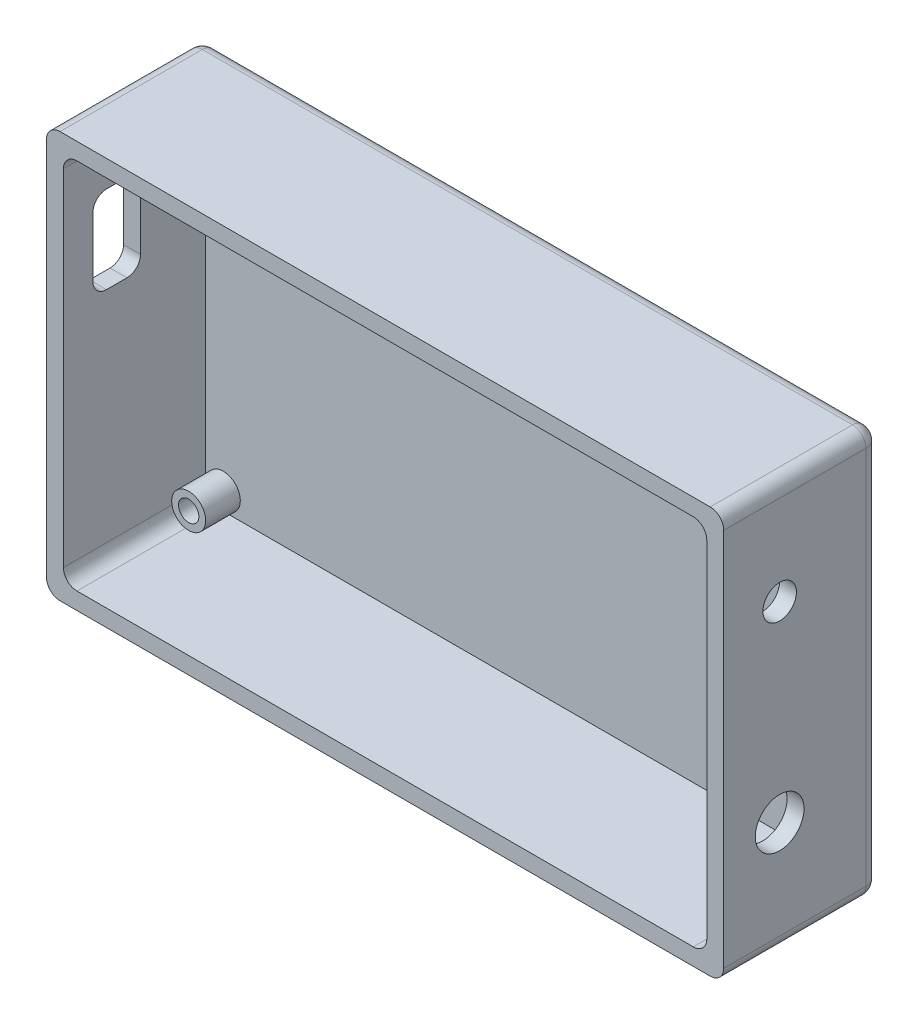
from build123d import *

# Parameters (mm, degrees)
SKETCH1_W                 = 100
SKETCH1_H                 = 60
BOSS_EXTRUDE1_DEPTH       = 23
SKETCH2_W                 = 95
SKETCH2_H                 = 55
CUT_EXTRUDE1_DEPTH        = 21
SKETCH3_R                 = 2.51
SKETCH3_R_2               = 1.5
BOSS_EXTRUDE6_DEPTH       = 5.112
MIRROR2_COPY_1_SKETCH_R   = 2.51
MIRROR2_COPY_1_SKETCH_R_2 = 1.5
MIRROR2_COPY_1_DEPTH      = 5.112
FILLET1_R                 = 2
CUT_EXTRUDE2_REACH        = 108.907
SKETCH4_W                 = 7.027664142
SKETCH4_H                 = 12.863273411
FILLET2_R                 = 2
CUT_EXTRUDE3_REACH        = 108.907
SKETCH5_R                 = 3.6
SKETCH5_R_2               = 2.475


with BuildPart() as part:
    # Sketch1 → Boss-Extrude1 (new body)
    with BuildSketch(Plane.XY):
        Rectangle(SKETCH1_W, SKETCH1_H)
    extrude(amount=BOSS_EXTRUDE1_DEPTH)

    # Sketch2 → Cut-Extrude1 (cut)
    with BuildSketch(Plane.XY.offset(23)):
        Rectangle(SKETCH2_W, SKETCH2_H)
    extrude(amount=-CUT_EXTRUDE1_DEPTH, mode=Mode.SUBTRACT)

    # Sketch3 → Boss-Extrude6 (add)
    with BuildSketch(Plane.XY.offset(2)):
        with Locations((-44.89, 24.89)):
            Circle(SKETCH3_R)
        with Locations((-44.89, 24.89)):
            Circle(SKETCH3_R_2, mode=Mode.SUBTRACT)
    boss_extrude6 = extrude(amount=BOSS_EXTRUDE6_DEPTH)

    # Mirror1: Boss-Extrude6 across plane
    add(boss_extrude6.mirror(Plane.ZX))

    # Mirror2: Boss-Extrude6 across plane
    add(boss_extrude6.mirror(Plane(origin=(0, 0, 0), x_dir=(0, 0, 1), z_dir=(1, 0, 0))))

    # Mirror2 copy 1 sketch → Mirror2 copy 1 (add)
    with BuildSketch(Plane(origin=(0, 0, 2), x_dir=(-1, 0, 0), z_dir=(0, 0, 1))):
        with Locations((-44.89, 24.89)):
            Circle(MIRROR2_COPY_1_SKETCH_R)
        with Locations((-44.89, 24.89)):
            Circle(MIRROR2_COPY_1_SKETCH_R_2, mode=Mode.SUBTRACT)
    extrude(amount=MIRROR2_COPY_1_DEPTH)

    # Fillet1
    fillet1_edges = [part.edges().sort_by_distance(p)[0] for p in [
        (-47.5, 27.5, 12.5),
        (47.5, 27.5, 12.5),
        (47.5, -27.5, 12.5),
        (-47.5, -27.5, 12.5),
        (0, -30, 0),
        (-50, 0, 0),
        (0, 30, 0),
        (50, 0, 0),
        (50, -30, 11.5),
        (-50, -30, 11.5),
        (-50, 30, 11.5),
        (50, 30, 11.5),
    ]]
    fillet(fillet1_edges, radius=FILLET1_R)

    # Sketch4 → Cut-Extrude2 (cut, up to next)
    with BuildSketch(Plane.ZY.offset(50), mode=Mode.PRIVATE) as cut_extrude2_sk1:
        with Locations((15.125832071, 13.291636706)):
            Rectangle(SKETCH4_W, SKETCH4_H)
    cut_extrude2_tool1 = extrude(cut_extrude2_sk1.sketch, amount=-CUT_EXTRUDE2_REACH, mode=Mode.PRIVATE) & part.part
    add(cut_extrude2_tool1.solids().sort_by_distance((-50, 13.291637, 15.125832))[0], mode=Mode.SUBTRACT)

    # Fillet2
    fillet2_edges = [part.edges().sort_by_distance(p)[0] for p in [
        (-48.75, 19.723273411, 11.612),
        (-48.75, 6.86, 11.612),
        (-48.75, 6.86, 18.639664142),
        (-48.75, 19.723273411, 18.639664142),
    ]]
    fillet(fillet2_edges, radius=FILLET2_R)

    # Sketch5 → Cut-Extrude3 (cut, up to next)
    with BuildSketch(Plane(origin=(50, 0, 0), x_dir=(0, 0, -1), z_dir=(1, 0, 0)), mode=Mode.PRIVATE) as cut_extrude3_sk1:
        with Locations((-14.74, -13.49)):
            Circle(SKETCH5_R)
    cut_extrude3_tool1 = extrude(cut_extrude3_sk1.sketch, amount=-CUT_EXTRUDE3_REACH, mode=Mode.PRIVATE) & part.part
    # Sketch5 → Cut-Extrude3 (cut, up to next)
    with BuildSketch(Plane(origin=(50, 0, 0), x_dir=(0, 0, -1), z_dir=(1, 0, 0)), mode=Mode.PRIVATE) as cut_extrude3_sk2:
        with Locations((-14.74, 14.76)):
            Circle(SKETCH5_R_2)
    cut_extrude3_tool2 = extrude(cut_extrude3_sk2.sketch, amount=-CUT_EXTRUDE3_REACH, mode=Mode.PRIVATE) & part.part
    add(cut_extrude3_tool1.solids().sort_by_distance((50, -13.49, 14.74))[0], mode=Mode.SUBTRACT)
    add(cut_extrude3_tool2.solids().sort_by_distance((50, 14.76, 14.74))[0], mode=Mode.SUBTRACT)


solid = part.part
